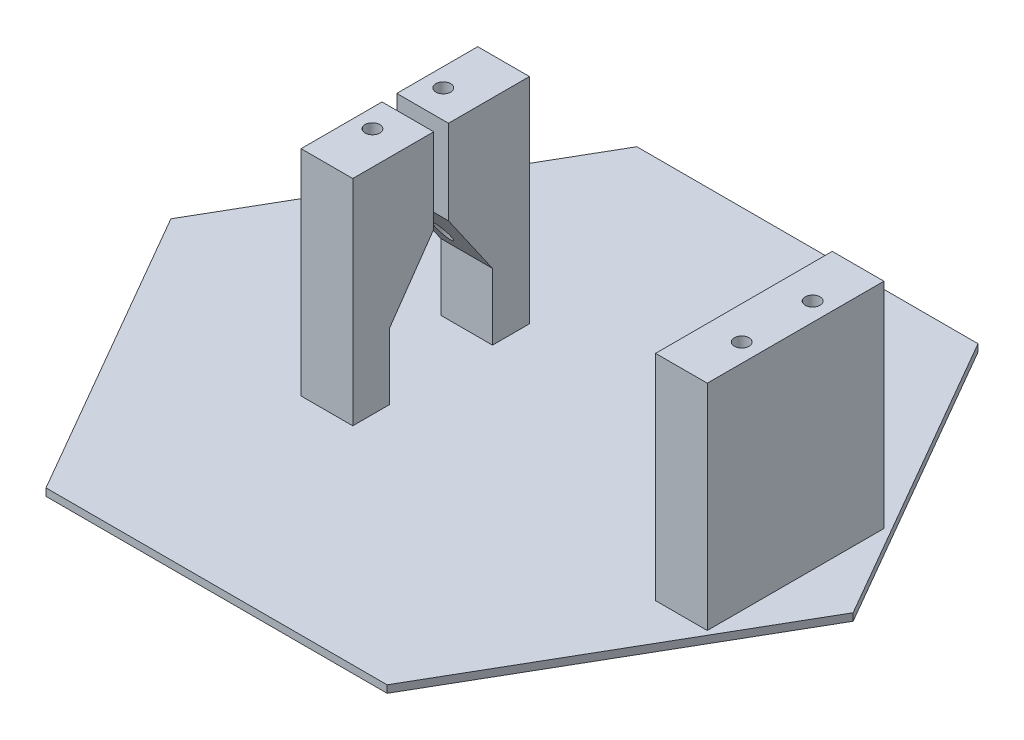
from build123d import *

# Parameters (mm, degrees)
BOSS_EXTRUDE1_DEPTH = 1
SKETCH2_R           = 1
SKETCH2_W           = 7
SKETCH2_H           = 23.92041254
SKETCH2_H_2         = 5
BOSS_EXTRUDE4_DEPTH = 29
BOSS_EXTRUDE5_DEPTH = 7
SKETCH2_4_R         = 1
CUT_EXTRUDE1_DEPTH  = 29
CUT_EXTRUDE2_REACH  = 70.069
SKETCH5_W           = 7
SKETCH5_H           = 2


with BuildPart() as part:
    # Sketch1 → Boss-Extrude1 (new body)
    with BuildSketch(Plane(origin=(0, 0, 0), x_dir=(1, 0, 0), z_dir=(0, 1, 0))):
        Polygon((46.188021535, 0), (23.094010768, 40), (-23.094010768, 40), (-46.188021535, 0), (-23.094010768, -40), (23.094010768, -40), align=None)
    extrude(amount=BOSS_EXTRUDE1_DEPTH)

    # Sketch2 → Boss-Extrude4 (add)
    # profile 1 of 5: a face of its own
    with BuildSketch(Plane(origin=(0, 1, 0), x_dir=(1, 0, 0), z_dir=(0, 1, 0))):
        with Locations(Location((-14.1, -4.8, 0), (0, 0, 90))):
            Circle(SKETCH2_R)
    # profile 2 of 5: a face of its own
    with BuildSketch(Plane(origin=(0, 1, 0), x_dir=(1, 0, 0), z_dir=(0, 1, 0))):
        with Locations(Location((-14.1, 4.8, 0), (0, 0, 90))):
            Circle(SKETCH2_R)
    # profile 3 of 5: a face of its own
    with BuildSketch(Plane(origin=(0, 1, 0), x_dir=(1, 0, 0), z_dir=(0, 1, 0))):
        with Locations((34.9, 0)):
            Rectangle(SKETCH2_W, SKETCH2_H)
        with Locations(Location((35.9, -4.8, 0), (0, 0, 90))):
            Circle(SKETCH2_R, mode=Mode.SUBTRACT)
        with Locations(Location((35.9, 4.8, 0), (0, 0, 90))):
            Circle(SKETCH2_R, mode=Mode.SUBTRACT)
    # profile 4 of 5: a face of its own
    with BuildSketch(Plane(origin=(0, 1, 0), x_dir=(1, 0, 0), z_dir=(0, 1, 0))):
        with Locations((-13.1, 9.46020627)):
            Rectangle(SKETCH2_W, SKETCH2_H_2)
    # profile 5 of 5: a face of its own
    with BuildSketch(Plane(origin=(0, 1, 0), x_dir=(1, 0, 0), z_dir=(0, 1, 0))):
        with Locations((-13.1, -9.46020627)):
            Rectangle(SKETCH2_W, SKETCH2_H_2)
    extrude(amount=BOSS_EXTRUDE4_DEPTH)

    # Sketch4 → Boss-Extrude5 (add)
    with BuildSketch(Plane.ZY.offset(16.6)):
        Polygon((-6.96020627, 10), (0, 20), (6.96020627, 10), (6.96020627, 30), (-6.96020627, 30), align=None)
    extrude(amount=-BOSS_EXTRUDE5_DEPTH)

    # Sketch2<4> → Cut-Extrude1 (cut)
    with BuildSketch(Plane(origin=(0, 1, 0), x_dir=(1, 0, 0), z_dir=(0, 1, 0))):
        with Locations(Location((-14.1, -4.8, 0), (0, 0, 90))):
            Circle(SKETCH2_4_R)
        with Locations(Location((-14.1, 4.8, 0), (0, 0, 90))):
            Circle(SKETCH2_4_R)
    extrude(amount=CUT_EXTRUDE1_DEPTH, mode=Mode.SUBTRACT)

    # Sketch5 → Cut-Extrude2 (cut, up to next)
    with BuildSketch(Plane(origin=(0, 30, 0), x_dir=(1, 0, 0), z_dir=(0, 1, 0)), mode=Mode.PRIVATE) as cut_extrude2_sk1:
        with Locations((-13.1, 0)):
            Rectangle(SKETCH5_W, SKETCH5_H)
    cut_extrude2_tool1 = extrude(cut_extrude2_sk1.sketch, amount=-CUT_EXTRUDE2_REACH, mode=Mode.PRIVATE) & part.part
    add(cut_extrude2_tool1.solids().sort_by_distance((-13.1, 30, 0))[0], mode=Mode.SUBTRACT)


solid = part.part
